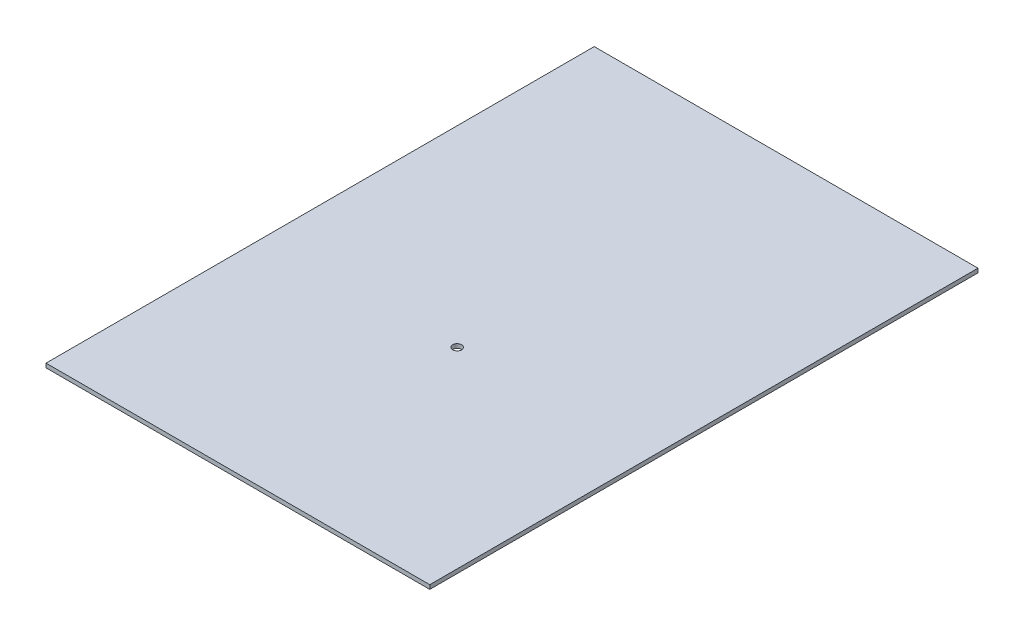
from build123d import *

# Parameters (mm, degrees)
SKETCH1_W           = 280
SKETCH1_H           = 400
SKETCH1_R           = 3.25
BOSS_EXTRUDE1_DEPTH = 3


with BuildPart() as part:
    # Sketch1 → Boss-Extrude1 (new body)
    with BuildSketch(Plane(origin=(0, 0, 0), x_dir=(1, 0, 0), z_dir=(0, 1, 0))):
        with Locations((140, 200)):
            Rectangle(SKETCH1_W, SKETCH1_H)
        with Locations(Location((140, 160, 0), (0, 0, 270))):
            Circle(SKETCH1_R, mode=Mode.SUBTRACT)
    extrude(amount=BOSS_EXTRUDE1_DEPTH)


solid = part.part
